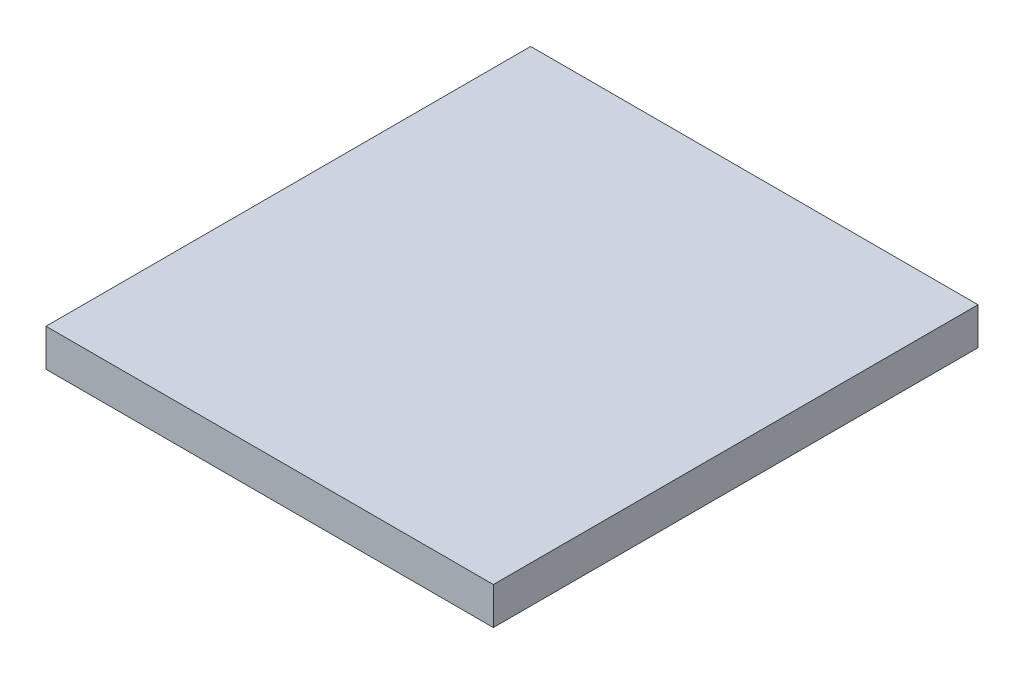
from build123d import *

# Parameters (mm, degrees)
KAP_AGIZ_KAPAGI_PC_1_START = -25
SKETCH1_W                  = 60
SKETCH1_H                  = 5
KAP_AGIZ_KAPAGI_PC_1_DEPTH = 65


with BuildPart() as part:
    # Sketch1 → KAP_agiz_kapagi_PC_1 (new body)
    with BuildSketch(Plane.XY.offset(KAP_AGIZ_KAPAGI_PC_1_START)):
        with Locations((0, 32.5)):
            Rectangle(SKETCH1_W, SKETCH1_H)
    extrude(amount=-KAP_AGIZ_KAPAGI_PC_1_DEPTH)


solid = part.part
